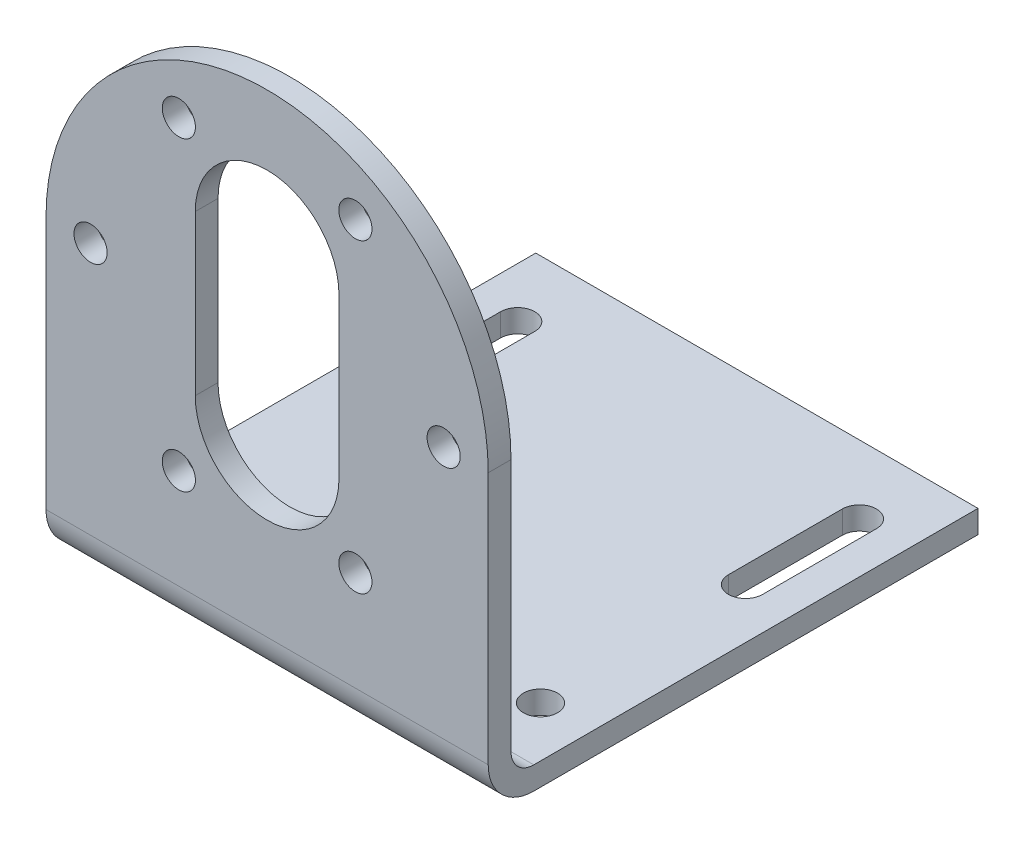
from build123d import *

# Parameters (mm, degrees)
SKETCH_2_R          = 1.455943363
EXTRUDE_1_DEPTH     = 2
SKETCH_3_W          = 38.825156346
SKETCH_3_H          = 2
EXTRUDE_2_DEPTH     = 43
SKETCH_4_R          = 1.5
CUT_EXTRUDE_1_DEPTH = 10
FILLET_1_R          = 4
FILLET_2_R          = 2


with BuildPart() as part:
    # 草图2 → 凸台-拉伸1 (new body)
    with BuildSketch(Plane.XY):
        with BuildLine():
            Line((-19.412578173, 26.206980534), (-19.412578173, 0))
            Line((-19.412578173, 0), (19.412578173, 0))
            Line((19.412578173, 0), (19.412578173, 26.206980534))
            ThreePointArc((19.412578173, 26.206980534), (0, 45.619558707), (-19.412578173, 26.206980534))
        make_face()
        with Locations((15.5, 26.206980534)):
            Circle(SKETCH_2_R, mode=Mode.SUBTRACT)
        with Locations((7.75, 12.783586775)):
            Circle(SKETCH_2_R, mode=Mode.SUBTRACT)
        with Locations((-7.75, 12.783586775)):
            Circle(SKETCH_2_R, mode=Mode.SUBTRACT)
        with Locations((-15.5, 26.206980534)):
            Circle(SKETCH_2_R, mode=Mode.SUBTRACT)
        with Locations((-7.75, 39.630374293)):
            Circle(SKETCH_2_R, mode=Mode.SUBTRACT)
        with Locations((7.75, 39.630374293)):
            Circle(SKETCH_2_R, mode=Mode.SUBTRACT)
        with BuildLine():
            Line((-6.309087906, 33.206980534), (-6.309087906, 19.206980534))
            ThreePointArc((-6.309087906, 19.206980534), (0, 12.897892628), (6.309087906, 19.206980534))
            Line((6.309087906, 19.206980534), (6.309087906, 33.206980534))
            ThreePointArc((6.309087906, 33.206980534), (0, 39.51606844), (-6.309087906, 33.206980534))
        make_face(mode=Mode.SUBTRACT)
    extrude(amount=EXTRUDE_1_DEPTH)

    # 草图3 → 凸台-拉伸2 (add)
    with BuildSketch(Plane.XY.offset(2)):
        with Locations((0, 1)):
            Rectangle(SKETCH_3_W, SKETCH_3_H)
    extrude(amount=-EXTRUDE_2_DEPTH)

    # 草图4 → 切除-拉伸1 (cut)
    with BuildSketch(Plane(origin=(0, 2, 0), x_dir=(1, 0, 0), z_dir=(0, 1, 0))):
        with Locations(Location((-15, 7, 0), (0, 0, 270))):
            Circle(SKETCH_4_R)
        with Locations(Location((15, 7, 0), (0, 0, 270))):
            Circle(SKETCH_4_R)
        with BuildLine():
            Line((-16.5, 35), (-16.5, 25))
            ThreePointArc((-16.5, 25), (-15, 23.5), (-13.5, 25))
            Line((-13.5, 25), (-13.5, 35))
            ThreePointArc((-13.5, 35), (-15, 36.5), (-16.5, 35))
        make_face()
        with BuildLine():
            Line((13.5, 35), (13.5, 25))
            ThreePointArc((13.5, 25), (15, 23.5), (16.5, 25))
            Line((16.5, 25), (16.5, 35))
            ThreePointArc((16.5, 35), (15, 36.5), (13.5, 35))
        make_face()
    extrude(amount=-CUT_EXTRUDE_1_DEPTH, mode=Mode.SUBTRACT)

    # 圆角1
    fillet_1_edges = [part.edges().sort_by_distance(p)[0] for p in [
        (0, 0, 2),
    ]]
    fillet(fillet_1_edges, radius=FILLET_1_R)

    # 圆角2
    fillet_2_edges = [part.edges().sort_by_distance(p)[0] for p in [
        (0, 2, 0),
    ]]
    fillet(fillet_2_edges, radius=FILLET_2_R)


solid = part.part
